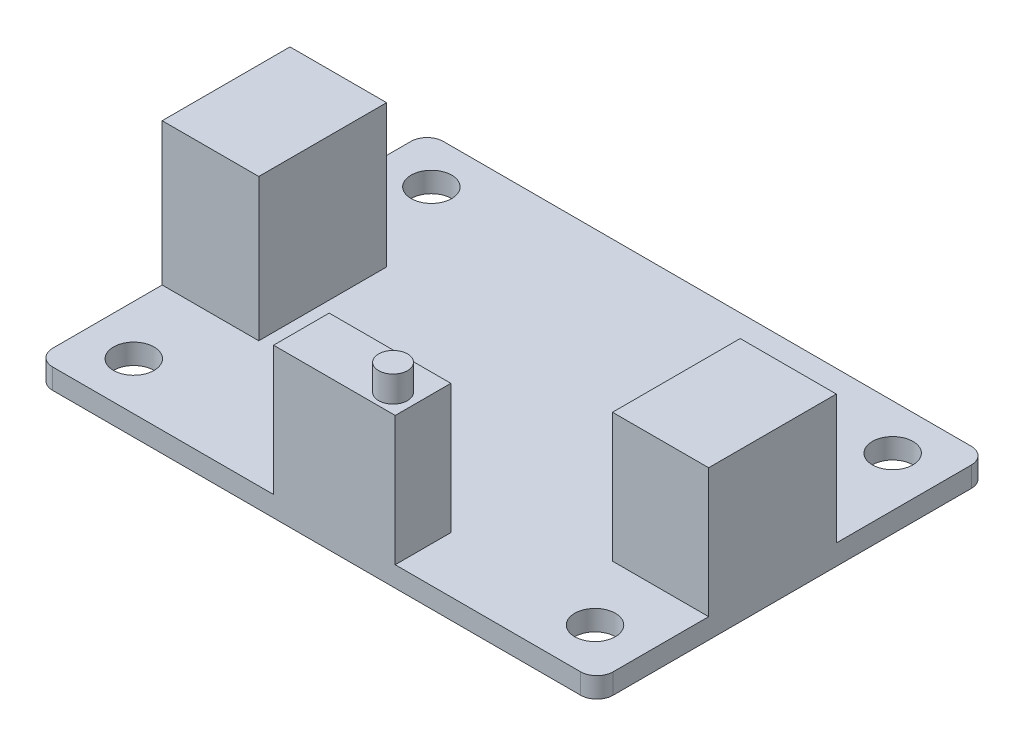
from build123d import *

# Parameters (mm, degrees)
SKETCH1_R           = 1.5875
BOSS_EXTRUDE4_DEPTH = 1.5875
SKETCH2_W           = 7.5057
SKETCH2_H           = 9.9695
BOSS_EXTRUDE5_DEPTH = 10.0711
SKETCH3_W           = 9.4996
SKETCH3_H           = 4.3434
BOSS_EXTRUDE6_DEPTH = 10.0965
SKETCH5_R           = 1.1303
BOSS_EXTRUDE7_DEPTH = 2.032
SKETCH6_W           = 7.5438
SKETCH6_H           = 9.9822
BOSS_EXTRUDE8_DEPTH = 11.1125


with BuildPart() as part:
    # Sketch1 → Boss-Extrude4 (new body)
    with BuildSketch(Plane(origin=(0, 0, 0), x_dir=(1, 0, 0), z_dir=(0, 1, 0))):
        with BuildLine():
            Line((21.881838929, -14.076705181), (21.881838929, 13.888694819))
            ThreePointArc((21.881838929, 13.888694819), (21.509864541, 14.786720431), (20.611838929, 15.158694819))
            Line((20.611838929, 15.158694819), (-20.612361071, 15.158694819))
            ThreePointArc((-20.612361071, 15.158694819), (-21.510386683, 14.786720431), (-21.882361071, 13.888694819))
            Line((-21.882361071, 13.888694819), (-21.882361071, -14.076705181))
            ThreePointArc((-21.882361071, -14.076705181), (-21.510386683, -14.974730793), (-20.612361071, -15.346705181))
            Line((-20.612361071, -15.346705181), (20.611838929, -15.346705181))
            ThreePointArc((20.611838929, -15.346705181), (21.509864541, -14.974730793), (21.881838929, -14.076705181))
        make_face()
        with Locations(Location((18.0086, 11.6205, 0), (0, 0, 270))):
            Circle(SKETCH1_R, mode=Mode.SUBTRACT)
        with Locations(Location((-18.0086, 11.6205, 0), (0, 0, 270))):
            Circle(SKETCH1_R, mode=Mode.SUBTRACT)
        with Locations(Location((-18.0086, -11.6205, 0), (0, 0, 270))):
            Circle(SKETCH1_R, mode=Mode.SUBTRACT)
        with Locations(Location((18.0086, -11.6205, 0), (0, 0, 270))):
            Circle(SKETCH1_R, mode=Mode.SUBTRACT)
    extrude(amount=BOSS_EXTRUDE4_DEPTH)

    # Sketch2 → Boss-Extrude5 (add)
    with BuildSketch(Plane(origin=(0, 1.5875, 0), x_dir=(1, 0, 0), z_dir=(0, 1, 0))):
        with Locations((18.128988929, -1.637055181)):
            Rectangle(SKETCH2_W, SKETCH2_H)
    extrude(amount=BOSS_EXTRUDE5_DEPTH)

    # Sketch3 → Boss-Extrude6 (add)
    with BuildSketch(Plane(origin=(0, 1.5875, 0), x_dir=(1, 0, 0), z_dir=(0, 1, 0))):
        with Locations((1.384038929, -13.175005181)):
            Rectangle(SKETCH3_W, SKETCH3_H)
    extrude(amount=BOSS_EXTRUDE6_DEPTH)

    # Sketch5 → Boss-Extrude7 (add)
    with BuildSketch(Plane(origin=(0, 11.684, 0), x_dir=(1, 0, 0), z_dir=(0, 1, 0))):
        with Locations(Location((4.485703039, -13.865914998, 0), (0, 0, 90))):
            Circle(SKETCH5_R)
    extrude(amount=BOSS_EXTRUDE7_DEPTH)

    # Sketch6 → Boss-Extrude8 (add)
    with BuildSketch(Plane(origin=(0, 1.5875, 0), x_dir=(1, 0, 0), z_dir=(0, 1, 0))):
        with Locations((-18.110461071, -0.538505181)):
            Rectangle(SKETCH6_W, SKETCH6_H)
    extrude(amount=BOSS_EXTRUDE8_DEPTH)


solid = part.part
